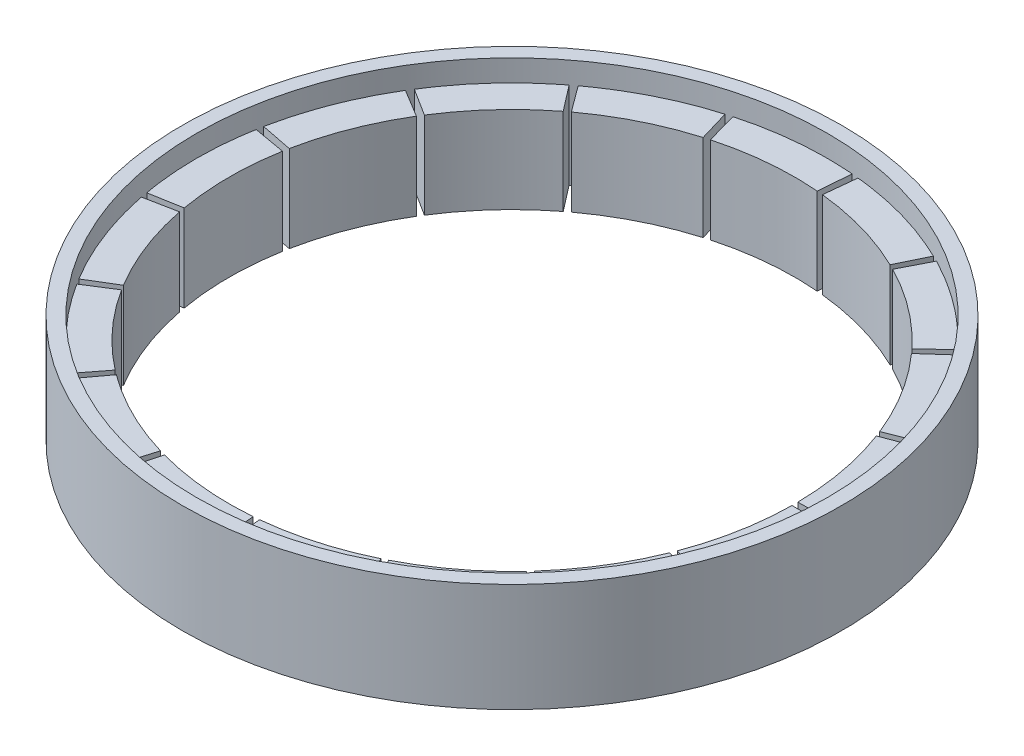
from build123d import *

# Parameters (mm, degrees)
SKETCH1_W         = 1.3
SKETCH1_H         = 10
SKETCH2_W         = 3
SKETCH2_H         = 8
REVOLVE2_ANGLE    = 20
CIRPATTERN2_COUNT = 17


with BuildPart() as part:
    # Sketch1 → Revolve1 (revolve)
    with BuildSketch(Plane.XY, mode=Mode.PRIVATE) as revolve1_sk:
        with Locations((-29.75, 11.75)):
            Rectangle(SKETCH1_W, SKETCH1_H)
    revolve(revolve1_sk.sketch.rotate(Axis((0, 0, 0), (0, -1, 0)), 270), axis=Axis((0, 0, 0), (0, -1, 0)))


with BuildPart() as body_2:
    # Sketch2 → Revolve2 (revolve, symmetric)
    with BuildSketch(Plane.XY) as revolve2_sk:
        with Locations((-27.6, 10.75)):
            Rectangle(SKETCH2_W, SKETCH2_H)
    revolve(axis=Axis((0, 0, 0), (0, 1, 0)), revolution_arc=REVOLVE2_ANGLE / 2)
    revolve(revolve2_sk.sketch, axis=Axis((0, 0, 0), (0, -1, 0)), revolution_arc=REVOLVE2_ANGLE / 2)


with BuildPart() as cirpattern2_1:
    # CirPattern2: pattern copy
    add(body_2.part.rotate(Axis((0, 0, 0), (0, 1, 0)), 1 * 360 / CIRPATTERN2_COUNT))


with BuildPart() as cirpattern2_2:
    # CirPattern2: pattern copy
    add(body_2.part.rotate(Axis((0, 0, 0), (0, 1, 0)), 2 * 360 / CIRPATTERN2_COUNT))


with BuildPart() as cirpattern2_3:
    # CirPattern2: pattern copy
    add(body_2.part.rotate(Axis((0, 0, 0), (0, 1, 0)), 3 * 360 / CIRPATTERN2_COUNT))


with BuildPart() as cirpattern2_4:
    # CirPattern2: pattern copy
    add(body_2.part.rotate(Axis((0, 0, 0), (0, 1, 0)), 4 * 360 / CIRPATTERN2_COUNT))


with BuildPart() as cirpattern2_5:
    # CirPattern2: pattern copy
    add(body_2.part.rotate(Axis((0, 0, 0), (0, 1, 0)), 5 * 360 / CIRPATTERN2_COUNT))


with BuildPart() as cirpattern2_6:
    # CirPattern2: pattern copy
    add(body_2.part.rotate(Axis((0, 0, 0), (0, 1, 0)), 6 * 360 / CIRPATTERN2_COUNT))


with BuildPart() as cirpattern2_7:
    # CirPattern2: pattern copy
    add(body_2.part.rotate(Axis((0, 0, 0), (0, 1, 0)), 7 * 360 / CIRPATTERN2_COUNT))


with BuildPart() as cirpattern2_8:
    # CirPattern2: pattern copy
    add(body_2.part.rotate(Axis((0, 0, 0), (0, 1, 0)), 8 * 360 / CIRPATTERN2_COUNT))


with BuildPart() as cirpattern2_9:
    # CirPattern2: pattern copy
    add(body_2.part.rotate(Axis((0, 0, 0), (0, 1, 0)), 9 * 360 / CIRPATTERN2_COUNT))


with BuildPart() as cirpattern2_10:
    # CirPattern2: pattern copy
    add(body_2.part.rotate(Axis((0, 0, 0), (0, 1, 0)), 10 * 360 / CIRPATTERN2_COUNT))


with BuildPart() as cirpattern2_11:
    # CirPattern2: pattern copy
    add(body_2.part.rotate(Axis((0, 0, 0), (0, 1, 0)), 11 * 360 / CIRPATTERN2_COUNT))


with BuildPart() as cirpattern2_12:
    # CirPattern2: pattern copy
    add(body_2.part.rotate(Axis((0, 0, 0), (0, 1, 0)), 12 * 360 / CIRPATTERN2_COUNT))


with BuildPart() as cirpattern2_13:
    # CirPattern2: pattern copy
    add(body_2.part.rotate(Axis((0, 0, 0), (0, 1, 0)), 13 * 360 / CIRPATTERN2_COUNT))


with BuildPart() as cirpattern2_14:
    # CirPattern2: pattern copy
    add(body_2.part.rotate(Axis((0, 0, 0), (0, 1, 0)), 14 * 360 / CIRPATTERN2_COUNT))


with BuildPart() as cirpattern2_15:
    # CirPattern2: pattern copy
    add(body_2.part.rotate(Axis((0, 0, 0), (0, 1, 0)), 15 * 360 / CIRPATTERN2_COUNT))


with BuildPart() as cirpattern2_16:
    # CirPattern2: pattern copy
    add(body_2.part.rotate(Axis((0, 0, 0), (0, 1, 0)), 16 * 360 / CIRPATTERN2_COUNT))


solid = Compound([part.part, body_2.part, cirpattern2_1.part, cirpattern2_2.part, cirpattern2_3.part, cirpattern2_4.part, cirpattern2_5.part, cirpattern2_6.part, cirpattern2_7.part, cirpattern2_8.part, cirpattern2_9.part, cirpattern2_10.part, cirpattern2_11.part, cirpattern2_12.part, cirpattern2_13.part, cirpattern2_14.part, cirpattern2_15.part, cirpattern2_16.part])
